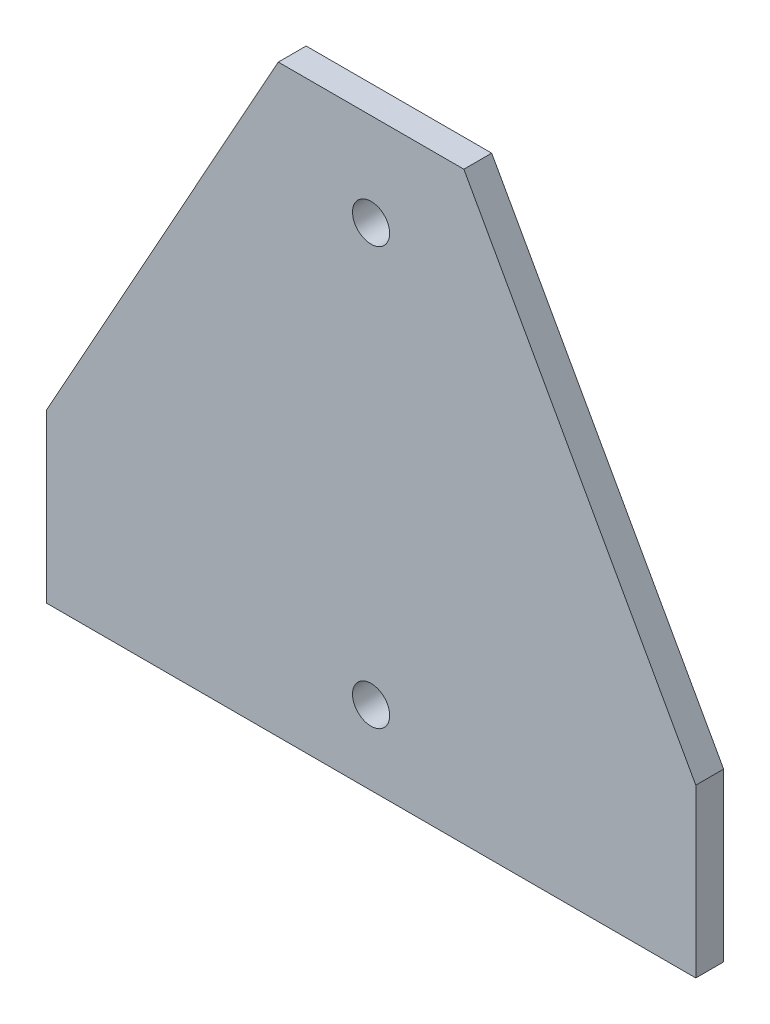
from build123d import *

# Parameters (mm, degrees)
IZIM1_R                     = 2
IZIM1_W                     = 70
IZIM1_H                     = 18
Y_KSEKLIK_EKSTR_ZYON1_DEPTH = 3


with BuildPart() as part:
    # Çizim1 → Yükseklik-Ekstrüzyon1 (new body)
    # profile 1 of 2: a face of its own
    with BuildSketch(Plane.XY):
        Polygon((45, 63), (70, 18), (0, 18), (25, 63), align=None)
        with Locations((35, 53)):
            Circle(IZIM1_R, mode=Mode.SUBTRACT)
    # profile 2 of 2: a face of its own
    with BuildSketch(Plane.XY):
        with Locations((35, 9)):
            Rectangle(IZIM1_W, IZIM1_H)
        with Locations((35, 8)):
            Circle(IZIM1_R, mode=Mode.SUBTRACT)
    extrude(amount=Y_KSEKLIK_EKSTR_ZYON1_DEPTH)


solid = part.part
